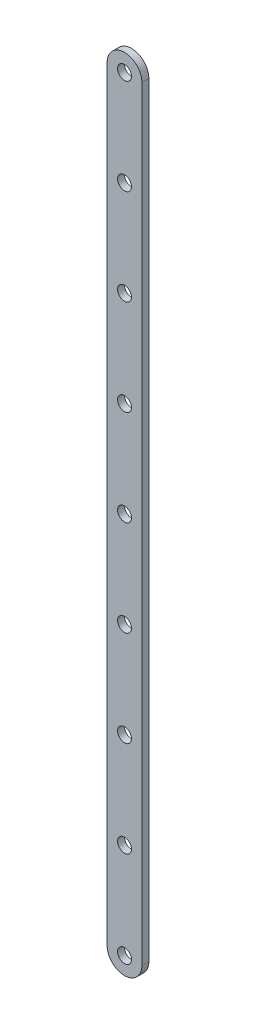
from build123d import *

# Parameters (mm, degrees)
SKETCH2_R           = 5
BOSS_EXTRUDE1_DEPTH = 5


with BuildPart() as part:
    # Sketch2 → Boss-Extrude1 (new body)
    with BuildSketch(Plane(origin=(0, 0, 0), x_dir=(0, 1, 0), z_dir=(0, 0, 1))):
        with BuildLine():
            Line((-275, 12.5), (275, 12.5))
            ThreePointArc((275, 12.5), (287.5, 0), (275, -12.5))
            Line((275, -12.5), (-275, -12.5))
            ThreePointArc((-275, -12.5), (-287.5, 0), (-275, 12.5))
        make_face()
        with Locations(Location((-275, 0, 0), (0, 0, 270))):
            Circle(SKETCH2_R, mode=Mode.SUBTRACT)
        with Locations(Location((-206.25, 0, 0), (0, 0, 270))):
            Circle(SKETCH2_R, mode=Mode.SUBTRACT)
        with Locations(Location((-137.5, 0, 0), (0, 0, 270))):
            Circle(SKETCH2_R, mode=Mode.SUBTRACT)
        with Locations(Location((-68.75, 0, 0), (0, 0, 270))):
            Circle(SKETCH2_R, mode=Mode.SUBTRACT)
        with Locations(Location((0, 0, 0), (0, 0, 270))):
            Circle(SKETCH2_R, mode=Mode.SUBTRACT)
        with Locations(Location((68.75, 0, 0), (0, 0, 270))):
            Circle(SKETCH2_R, mode=Mode.SUBTRACT)
        with Locations(Location((137.5, 0, 0), (0, 0, 270))):
            Circle(SKETCH2_R, mode=Mode.SUBTRACT)
        with Locations(Location((206.25, 0, 0), (0, 0, 270))):
            Circle(SKETCH2_R, mode=Mode.SUBTRACT)
        with Locations(Location((275, 0, 0), (0, 0, 270))):
            Circle(SKETCH2_R, mode=Mode.SUBTRACT)
    extrude(amount=BOSS_EXTRUDE1_DEPTH)


solid = part.part
